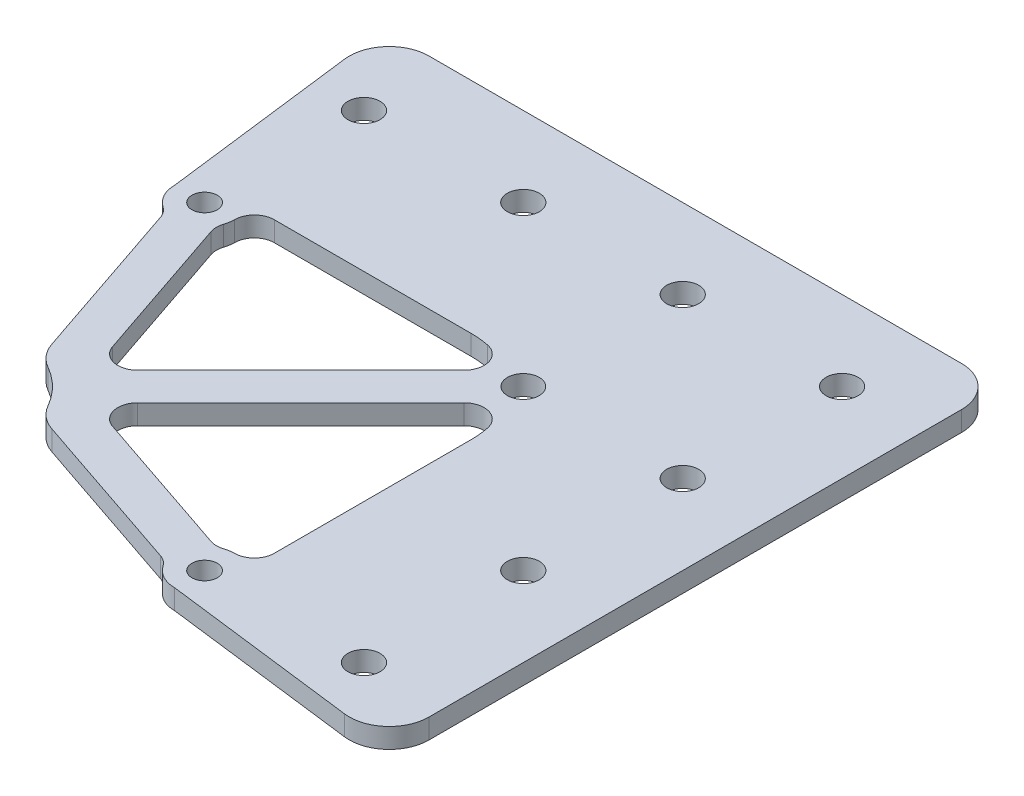
from build123d import *

# Parameters (mm, degrees)
SKETCH1_W                  = 127
SKETCH1_H                  = 127
BOSS_EXTRUDE_1_DEPTH       = 3.175
SKETCH5_R                  = 2.5273
SKETCH5_R_2                = 2.0193
CUT_EXTRUDE1_DEPTH         = 90.858670283
FILLET1_R                  = 6.35
FILLET2_R                  = 6.35
FILLET3_R                  = 6.35
F_10_CLEARANCE_HOLE1_D     = 5.1054
F_10_CLEARANCE_HOLE1_DEPTH = 9.906
F_10_CLEARANCE_HOLE1_TIP   = 1.533816902


with BuildPart() as part:
    # Sketch1 → Boss-Extrude 1 (new body)
    with BuildSketch(Plane(origin=(0, 0, 0), x_dir=(1, 0, 0), z_dir=(0, 1, 0))):
        Rectangle(SKETCH1_W, SKETCH1_H)
    extrude(amount=BOSS_EXTRUDE_1_DEPTH)

    # Sketch5 → Cut-Extrude1 (cut, through all)
    with BuildSketch(Plane.XZ):
        with BuildLine():
            ThreePointArc((-30.1625, -25.4), (-29.613538389, -23.180202601), (-28.093208455, -21.472146328))
            ThreePointArc((-28.093208455, -21.472146328), (-27.35728191, -20.769991802), (-26.881161446, -19.871149123))
            Line((-26.881161446, -19.871149123), (-17.158114653, 8.86613294))
            ThreePointArc((-17.158114653, 8.86613294), (-12.122211864, 12.122211864), (-8.86613294, 17.158114653))
            Line((-8.86613294, 17.158114653), (19.871149123, 26.881161446))
            ThreePointArc((19.871149123, 26.881161446), (20.769991802, 27.35728191), (21.472146328, 28.093208455))
            ThreePointArc((21.472146328, 28.093208455), (23.180202601, 29.613538389), (25.4, 30.1625))
            Line((25.4, 30.1625), (63.5, 34.925))
            Line((63.5, 34.925), (63.5, 63.5))
            Line((63.5, 63.5), (-63.5, 63.5))
            Line((-63.5, 63.5), (-63.5, -63.5))
            Line((-63.5, -63.5), (-34.925, -63.5))
            Line((-34.925, -63.5), (-30.1625, -25.4))
        make_face()
        with BuildLine():
            ThreePointArc((16.821574871, -28.281660245), (19.229977614, -26.085792739), (18.434943467, -22.925071528))
            Line((18.434943467, -22.925071528), (-7.573712289, 3.083584229))
            ThreePointArc((-7.573712289, 3.083584229), (-10.541284963, 3.930219773), (-12.826295631, 1.856092108))
            Line((-12.826295631, 1.856092108), (-20.866122824, -21.906292943))
            ThreePointArc((-20.866122824, -21.906292943), (-21.033571343, -22.90957249), (-20.875162107, -23.914318912))
            ThreePointArc((-20.875162107, -23.914318912), (-20.697290849, -24.647714886), (-20.6375, -25.4))
            ThreePointArc((-20.6375, -25.4), (-19.70756403, -27.64506403), (-17.4625, -28.575))
            Line((-17.4625, -28.575), (13.902307909, -28.575))
            ThreePointArc((13.902307909, -28.575), (15.369291874, -28.501480873), (16.821574871, -28.281660245))
        make_face()
        with BuildLine():
            ThreePointArc((28.281660245, -16.821574871), (28.501480873, -15.369291874), (28.575, -13.902307909))
            Line((28.575, -13.902307909), (28.575, 17.4625))
            ThreePointArc((28.575, 17.4625), (27.64506403, 19.70756403), (25.4, 20.6375))
            ThreePointArc((25.4, 20.6375), (24.647714886, 20.697290849), (23.914318912, 20.875162107))
            ThreePointArc((23.914318912, 20.875162107), (22.90957249, 21.033571343), (21.906292943, 20.866122824))
            Line((21.906292943, 20.866122824), (-1.856092108, 12.826295631))
            ThreePointArc((-1.856092108, 12.826295631), (-3.930219773, 10.541284963), (-3.083584229, 7.573712289))
            Line((-3.083584229, 7.573712289), (22.925071528, -18.434943467))
            ThreePointArc((22.925071528, -18.434943467), (26.085792739, -19.229977614), (28.281660245, -16.821574871))
        make_face()
        with Locations(Location((25.4, -25.4, 0), (0, 0, 270))):
            Circle(SKETCH5_R)
        with Locations(Location((-25.4, -25.4, 0), (0, 0, 270))):
            Circle(SKETCH5_R_2)
        with Locations(Location((25.4, 25.4, 0), (0, 0, 270))):
            Circle(SKETCH5_R_2)
    extrude(amount=-CUT_EXTRUDE1_DEPTH, mode=Mode.SUBTRACT)

    # Fillet1
    fillet1_edges = [part.edges().sort_by_distance(p)[0] for p in [
        (63.5, 1.5875, -63.5),
    ]]
    fillet(fillet1_edges, radius=FILLET1_R)

    # Fillet2
    fillet2_edges = [part.edges().sort_by_distance(p)[0] for p in [
        (-34.925, 1.5875, -63.5),
        (63.5, 1.5875, 34.925),
    ]]
    fillet(fillet2_edges, radius=FILLET2_R)

    # Fillet3
    fillet3_edges = [part.edges().sort_by_distance(p)[0] for p in [
        (-8.86613294, 1.5875, 17.158114653),
        (-17.158114653, 1.5875, 8.86613294),
    ]]
    fillet(fillet3_edges, radius=FILLET3_R)

    # #10 Clearance Hole1
    with Locations(Plane(origin=(0, 0, 0), x_dir=(-1, 0, 0), z_dir=(0, -1, 0))):
        with Locations((-50.8, 50.8), (-25.4, 50.8), (38.1, 50.8), (50.8, 50.8), (0, 50.8), (76.2, 50.8), (25.4, 50.8), (-50.8, 25.4), (-50.8, 0), (-50.8, -25.4), (-50.8, -50.8), (-50.8, -76.2)):
            Hole(F_10_CLEARANCE_HOLE1_D / 2, depth=F_10_CLEARANCE_HOLE1_DEPTH)
            with Locations((0, 0, -(F_10_CLEARANCE_HOLE1_DEPTH + F_10_CLEARANCE_HOLE1_TIP / 2))):  # 118° drill point
                Cone(0, F_10_CLEARANCE_HOLE1_D / 2, F_10_CLEARANCE_HOLE1_TIP, mode=Mode.SUBTRACT)


solid = part.part
